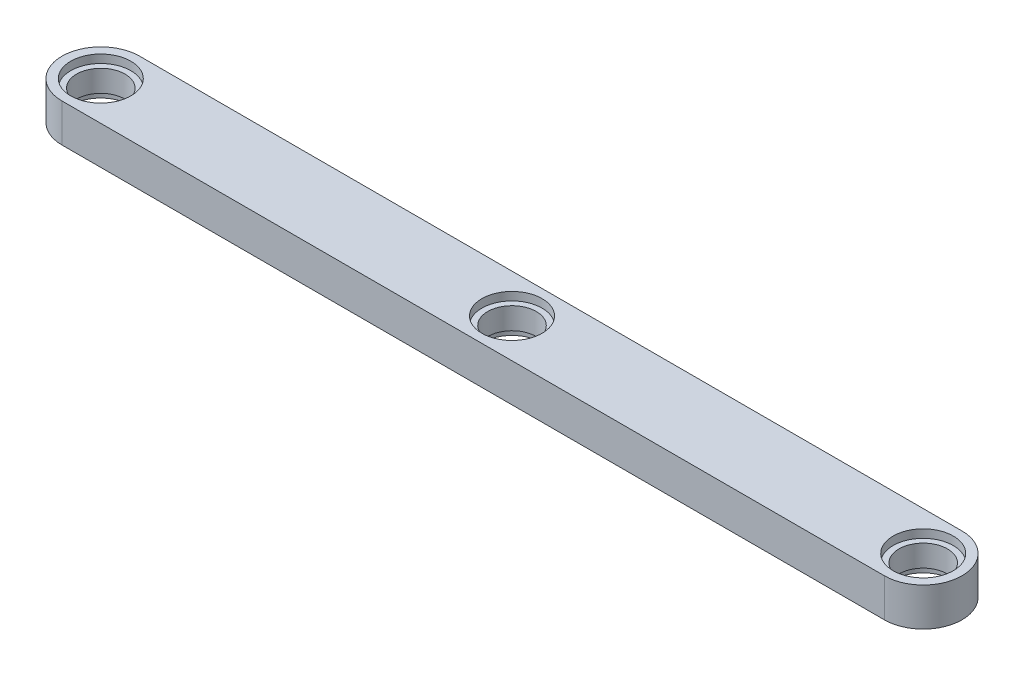
from build123d import *

# Parameters (mm, degrees)
CROQUIS1_R              = 3.1
SALIENTE_EXTRUIR1_DEPTH = 3.935
SALIENTE_EXTRUIR2_START = 0.85
CROQUIS1_3_R            = 3.1
CROQUIS1_3_R_2          = 2.5
SALIENTE_EXTRUIR2_DEPTH = 2.235


with BuildPart() as part:
    # Croquis1 → Saliente-Extruir1 (new body)
    with BuildSketch(Plane(origin=(0, 0, 0), x_dir=(1, 0, 0), z_dir=(0, 1, 0))):
        with BuildLine():
            Line((0, 4), (84.76, 4))
            ThreePointArc((84.76, 4), (88.76, 0), (84.76, -4))
            Line((84.76, -4), (0, -4))
            ThreePointArc((0, -4), (-4, 0), (0, 4))
        make_face()
        with Locations(Location((0, 0, 0), (0, 0, 270))):
            Circle(CROQUIS1_R, mode=Mode.SUBTRACT)
        with Locations(Location((84.76, 0, 0), (0, 0, 270))):
            Circle(CROQUIS1_R, mode=Mode.SUBTRACT)
        with Locations(Location((42.38, 0, 0), (0, 0, 270))):
            Circle(CROQUIS1_R, mode=Mode.SUBTRACT)
    extrude(amount=SALIENTE_EXTRUIR1_DEPTH)

    # Croquis1<3> → Saliente-Extruir2 (add)
    # profile 1 of 3: a face of its own
    with BuildSketch(Plane(origin=(0, 0, 0), x_dir=(1, 0, 0), z_dir=(0, 1, 0)).offset(SALIENTE_EXTRUIR2_START)):
        with Locations(Location((0, 0, 0), (0, 0, 270))):
            Circle(CROQUIS1_3_R)
        with Locations(Location((0, 0, 0), (0, 0, 270))):
            Circle(CROQUIS1_3_R_2, mode=Mode.SUBTRACT)
    # profile 2 of 3: a face of its own
    with BuildSketch(Plane(origin=(0, 0, 0), x_dir=(1, 0, 0), z_dir=(0, 1, 0)).offset(SALIENTE_EXTRUIR2_START)):
        with Locations(Location((84.76, 0, 0), (0, 0, 270))):
            Circle(CROQUIS1_3_R)
        with Locations(Location((84.76, 0, 0), (0, 0, 270))):
            Circle(CROQUIS1_3_R_2, mode=Mode.SUBTRACT)
    # profile 3 of 3: a face of its own
    with BuildSketch(Plane(origin=(0, 0, 0), x_dir=(1, 0, 0), z_dir=(0, 1, 0)).offset(SALIENTE_EXTRUIR2_START)):
        with Locations(Location((42.38, 0, 0), (0, 0, 270))):
            Circle(CROQUIS1_3_R)
        with Locations(Location((42.38, 0, 0), (0, 0, 270))):
            Circle(CROQUIS1_3_R_2, mode=Mode.SUBTRACT)
    extrude(amount=SALIENTE_EXTRUIR2_DEPTH)


solid = part.part
